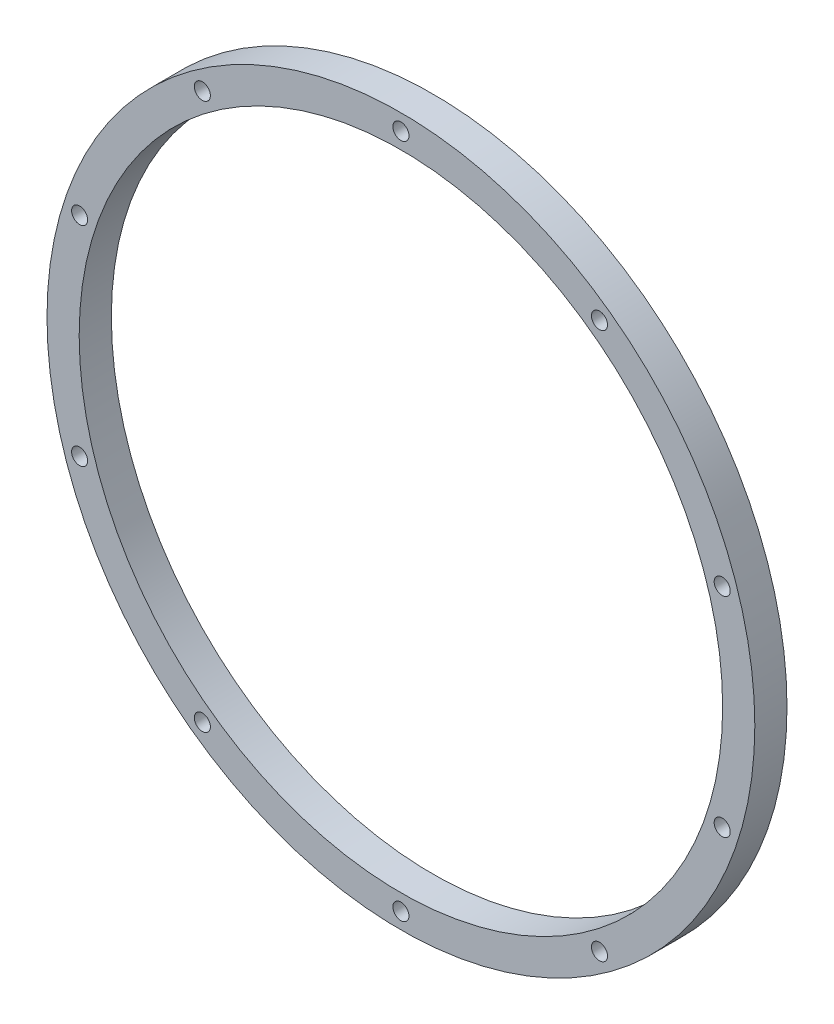
from build123d import *

# Parameters (mm, degrees)
SKETCH_1_R               = 128.7
SKETCH_1_R_2             = 117
EXTRUDE_2_DEPTH          = 11.7
SKETCH_2_R               = 2.925
CUT_EXTRUDE_2_DEPTH      = 183.384950037
PATTERN_CIRCULAR_1_COUNT = 10


with BuildPart() as part:
    # Эскиз1 → Бобышка-Вытянуть2 (new body)
    with BuildSketch(Plane.XY):
        Circle(SKETCH_1_R)
        Circle(SKETCH_1_R_2, mode=Mode.SUBTRACT)
    extrude(amount=-EXTRUDE_2_DEPTH)

    # Эскиз2 → Вырез-Вытянуть2 (cut, through all)
    with BuildSketch(Plane.XY):
        with Locations((0, 122.85)):
            Circle(SKETCH_2_R)
    cut_extrude_2 = extrude(amount=-CUT_EXTRUDE_2_DEPTH, mode=Mode.SUBTRACT)

    # Круговой массив1: Вырез-Вытянуть2 ×10 about axis
    pattern_circular_1_axis = Axis((0, 0, 0), (0, 0, 1))
    for i in range(1, PATTERN_CIRCULAR_1_COUNT):
        add(cut_extrude_2.rotate(pattern_circular_1_axis, i * 360 / PATTERN_CIRCULAR_1_COUNT), mode=Mode.SUBTRACT)


solid = part.part
